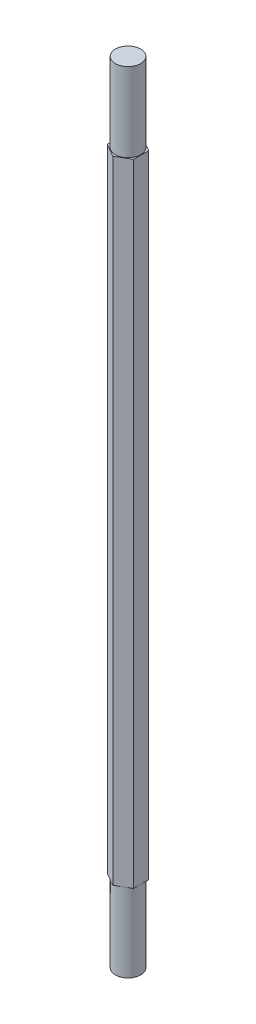
from build123d import *

# Parameters (mm, degrees)
BOSS_EXTRUDE1_DEPTH = 190.5
SKETCH2_OUTSIDE_W   = 46.489
SKETCH2_OUTSIDE_H   = 47.459
SKETCH2_OUTSIDE_R   = 3.048
CUT_EXTRUDE1_DEPTH  = 19.05


with BuildPart() as part:
    # Sketch1 → Boss-Extrude1 (new body)
    with BuildSketch(Plane(origin=(0, 0, 0), x_dir=(1, 0, 0), z_dir=(0, 1, 0))):
        Polygon((3.310191022, -4.420128359), (3.310191022, -0.762528359), (0.140765019, 1.063061018), (-3.028660983, -0.762528359), (-3.028660983, -4.420128359), (0.140765019, -6.245717737), align=None)
    extrude(amount=BOSS_EXTRUDE1_DEPTH)

    # Sketch2 outside → Cut-Extrude1 (cut)
    with BuildSketch(Plane(origin=(0, 190.5, 0), x_dir=(1, 0, 0), z_dir=(0, 1, 0))):
        with Locations((0.1405, -2.5915)):
            Rectangle(SKETCH2_OUTSIDE_W, SKETCH2_OUTSIDE_H)
        with Locations(Location((0.146339017, -2.591328359, 0), (0, 0, 270))):
            Circle(SKETCH2_OUTSIDE_R, mode=Mode.SUBTRACT)
    cut_extrude1 = extrude(amount=-CUT_EXTRUDE1_DEPTH, mode=Mode.SUBTRACT)

    # Mirror1: Cut-Extrude1 across plane
    add(cut_extrude1.mirror(Plane.ZX.offset(95.25)), mode=Mode.SUBTRACT)


solid = part.part
